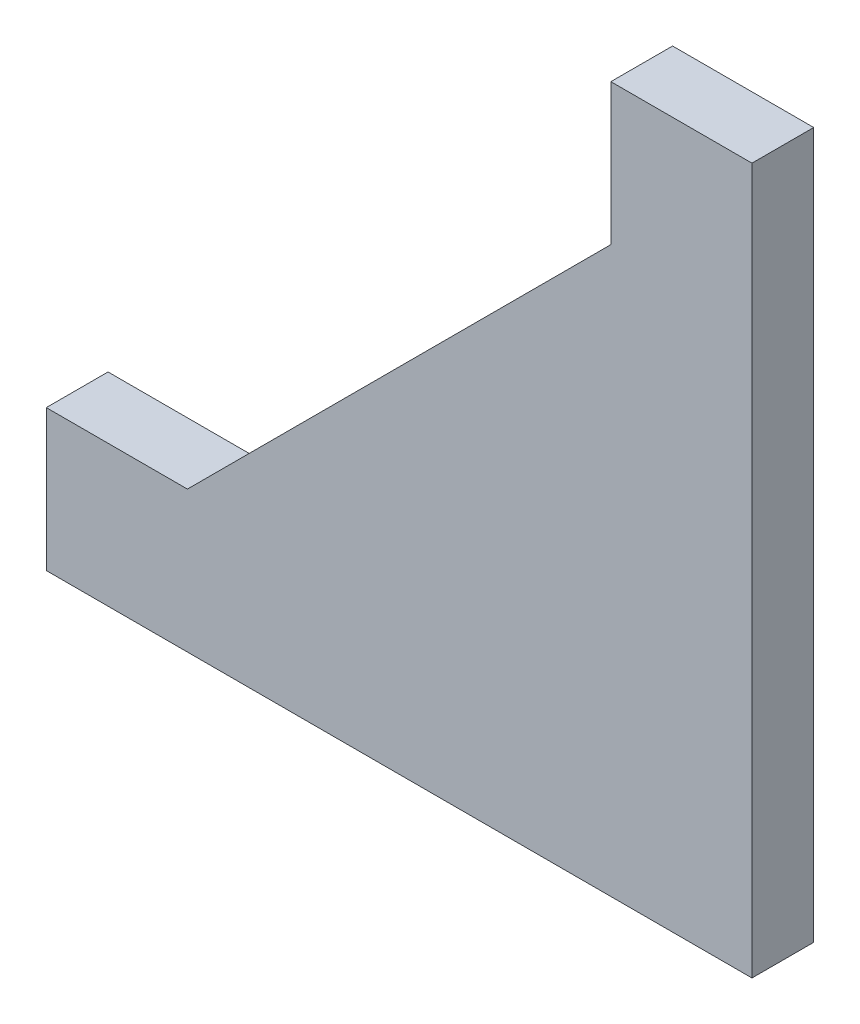
from build123d import *

# Parameters (mm, degrees)
EXTRUDE_1_DEPTH = 3.5


with BuildPart() as part:
    # 草图1 → 凸台-拉伸1 (new body)
    with BuildSketch(Plane.XY):
        Polygon((0, 0), (-40, 0), (-40, 8), (-32, 8), (-8, 32), (-8, 40), (0, 40), align=None)
    extrude(amount=EXTRUDE_1_DEPTH)


solid = part.part
